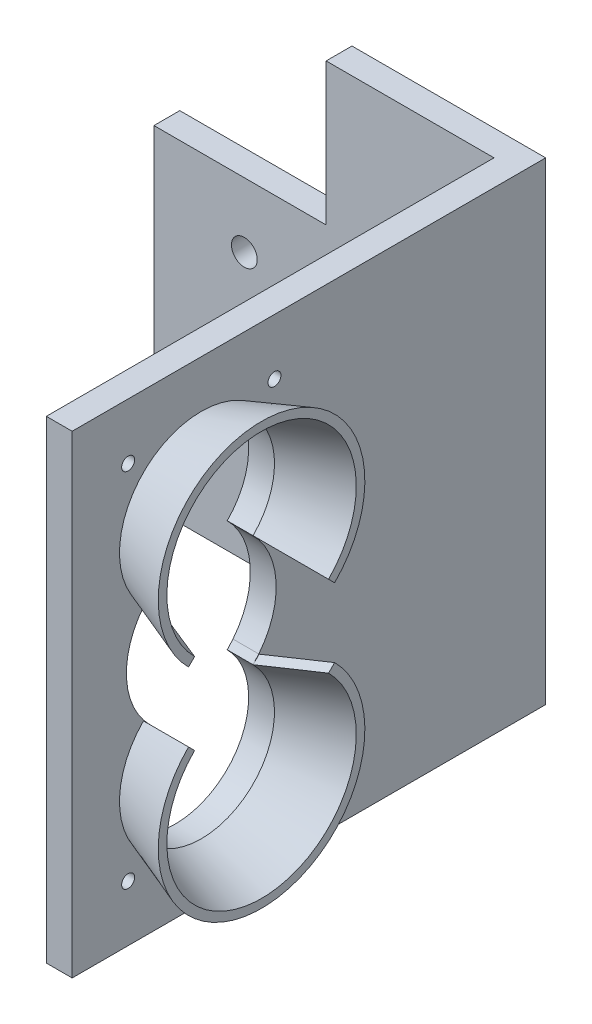
from build123d import *

# Parameters (mm, degrees)
EXTRUDE_1_DEPTH       = 27.5
SKETCH_3_R            = 0.75
CUT_EXTRUDE_3_DEPTH   = 3
REVOLVE_1_ANGLE       = 135
MIRROR_3_COPY_1_ANGLE = 135
MIRROR_3_COPY_2_ANGLE = 135
SKETCH_2_W            = 20
SKETCH_2_H            = 16.5
SKETCH_2_R            = 1.5
CUT_EXTRUDE_4_DEPTH   = 3


with BuildPart() as part:
    # 草图1 → 凸台-拉伸1 (new, symmetric)
    with BuildSketch(Plane(origin=(0, 0, 0), x_dir=(1, 0, 0), z_dir=(0, 1, 0))):
        Polygon((-16.617647059, 27.284313725), (25.882352941, 27.284313725), (25.882352941, -27.715686275), (22.882352941, -27.715686275), (22.882352941, 24.284313725), (-16.617647059, 24.284313725), align=None)
    extrude(amount=EXTRUDE_1_DEPTH, both=True)

    # 草图3 → 切除-拉伸3 (cut)
    with BuildSketch(Plane(origin=(25.882352941, 0, 0), x_dir=(0, 0, -1), z_dir=(1, 0, 0))):
        with BuildLine():
            ThreePointArc((-19.394463571, 5.743970558), (-21.414171084, 0), (-19.394463571, -5.743970558))
            Line((-19.394463571, -5.743970558), (-18.726093915, -6.48959236))
            ThreePointArc((-18.726093915, -6.48959236), (-12.715686275, -21), (-6.705278634, -6.48959236))
            Line((-6.705278634, -6.48959236), (-6.036908978, -5.743970558))
            ThreePointArc((-6.036908978, -5.743970558), (-4.017201465, 0), (-6.036908978, 5.743970558))
            Line((-6.036908978, 5.743970558), (-6.705278634, 6.48959236))
            ThreePointArc((-6.705278634, 6.48959236), (-12.715686275, 21), (-18.726093915, 6.48959236))
            Line((-18.726093915, 6.48959236), (-19.394463571, 5.743970558))
        make_face()
        with Locations((-4.215686275, -21)):
            Circle(SKETCH_3_R)
        with Locations((-21.215686275, -21)):
            Circle(SKETCH_3_R)
        with Locations((-4.215686275, 21)):
            Circle(SKETCH_3_R)
        with Locations((-21.215686275, 21)):
            Circle(SKETCH_3_R)
    extrude(amount=-CUT_EXTRUDE_3_DEPTH, mode=Mode.SUBTRACT)

    # 草图5 → 旋转1 (revolve)
    with BuildSketch(Plane(origin=(0, 0, 12.715686275), x_dir=(0, -1, 0), z_dir=(0, 0, 1))):
        Polygon((-22, 25.882352941), (-24.5, 32.882352941), (-23.5, 32.882352941), (-21, 25.882352941), align=None)
    revolve_1 = revolve(axis=Axis((32.882352941, 12.5, 12.715686275), (-1, 0, 0)), revolution_arc=REVOLVE_1_ANGLE)

    # 镜向1: 旋转1 across plane
    add(revolve_1.mirror(Plane.ZX))

    # 镜向2: 旋转1 across plane
    add(revolve_1.mirror(Plane.XY.offset(12.715686275)))

    # 镜向3 copy 1 sketch → 镜向3 copy 1 (revolve)
    with BuildSketch(Plane.YX.offset(-12.715686275)):
        Polygon((-22, 25.882352941), (-24.5, 32.882352941), (-23.5, 32.882352941), (-21, 25.882352941), align=None)
    revolve(axis=Axis((32.882352941, -12.5, 12.715686275), (-1, 0, 0)), revolution_arc=MIRROR_3_COPY_1_ANGLE)

    # 镜向3 copy 2 sketch → 镜向3 copy 2 (revolve)
    with BuildSketch(Plane(origin=(0, 0, 12.715686275), x_dir=(0, -1, 0), z_dir=(0, 0, -1))):
        Polygon((-22, -25.882352941), (-24.5, -32.882352941), (-23.5, -32.882352941), (-21, -25.882352941), align=None)
    revolve(axis=Axis((32.882352941, 12.5, 12.715686275), (1, 0, 0)), revolution_arc=MIRROR_3_COPY_2_ANGLE)

    # 草图2 → 切除-拉伸4 (cut)
    with BuildSketch(Plane(origin=(0, 0, -27.284313725), x_dir=(-1, 0, 0), z_dir=(0, 0, -1))):
        with Locations((6.617647059, 19.25)):
            Rectangle(SKETCH_2_W, SKETCH_2_H)
        with Locations((-13.882352941, 3.5)):
            Circle(SKETCH_2_R)
        with Locations((6.117647059, 3.5)):
            Circle(SKETCH_2_R)
    extrude(amount=-CUT_EXTRUDE_4_DEPTH, mode=Mode.SUBTRACT)


solid = part.part
